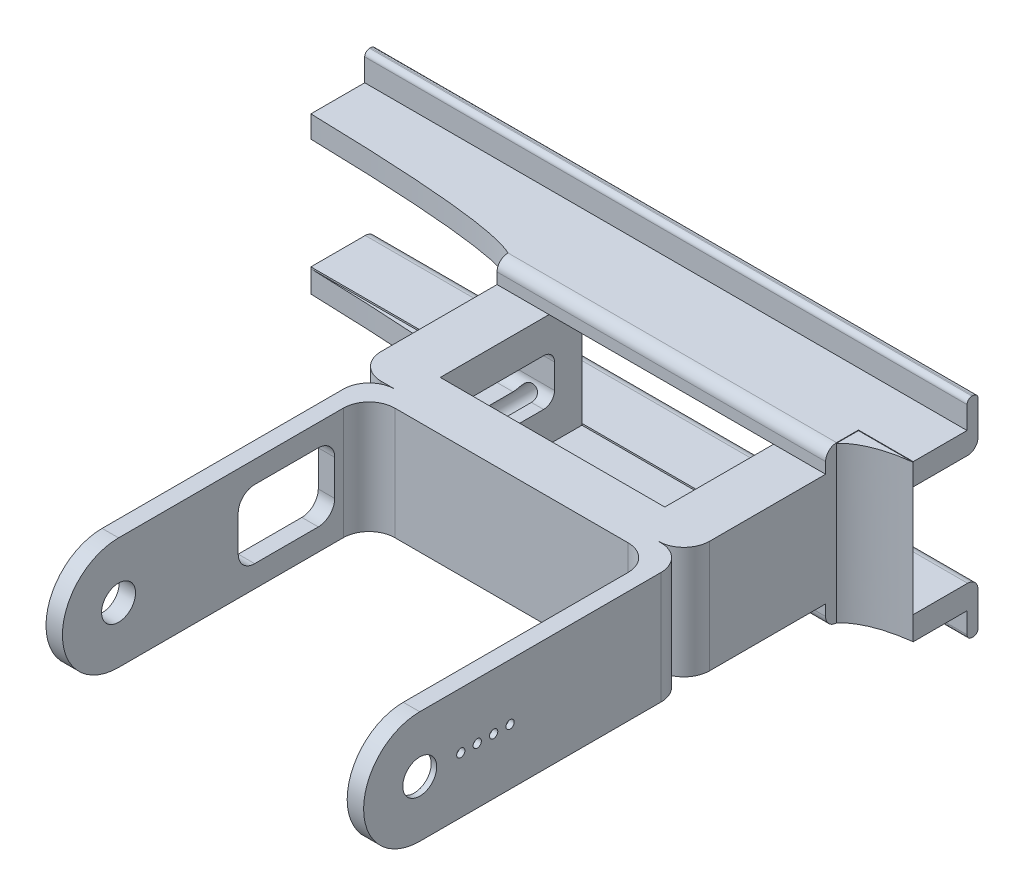
from build123d import *

# Parameters (mm, degrees)
AUFSATZ_LINEAR_AUSTRAGEN1_DEPTH      = 20.5
SCHNITT_LINEAR_AUSTRAGEN1_DEPTH      = 85.1
SKIZZE3_R                            = 3.1
SCHNITT_LINEAR_AUSTRAGEN2_DEPTH      = 87.42
SCHNITT_LINEAR_AUSTRAGEN3_DEPTH      = 2
SKIZZE5_R                            = 0.75
SCHNITT_LINEAR_AUSTRAGEN4_DEPTH      = 2
AUFSATZ_LINEAR_AUSTRAGEN2_DEPTH      = 20.5
SKIZZE7_W                            = 9.5
SKIZZE7_H                            = 20.5
AUFSATZ_LINEAR_AUSTRAGEN3_DEPTH      = 25.87
SCHNITT_LINEAR_AUSTRAGEN5_DEPTH      = 18.09
SKIZZE9_R                            = 1.75
SCHNITT_LINEAR_AUSTRAGEN6_DEPTH      = 24.9
AUFSATZ_LINEAR_AUSTRAGEN4_DEPTH      = 60
AUFSATZ_LINEAR_AUSTRAGEN5_DEPTH      = 40
AUFSATZ_LINEAR_AUSTRAGEN5_DEPTH_BACK = 70
AUFSATZ_LINEAR_AUSTRAGEN6_DEPTH      = 4
AUFSATZ_LINEAR_AUSTRAGEN7_DEPTH      = 4
AUFSATZ_LINEAR_AUSTRAGEN8_DEPTH      = 28.4
SCHNITT_LINEAR_AUSTRAGEN7_DEPTH      = 3


with BuildPart() as part:
    # Skizze1 → Aufsatz-Linear austragen1 (new body)
    with BuildSketch(Plane(origin=(0, 0, 0), x_dir=(1, 0, 0), z_dir=(0, 1, 0))):
        with BuildLine():
            Line((0, 54.3), (0, 0))
            Line((0, 0), (3, 0))
            Line((3, 0), (3, 51.3))
            ThreePointArc((3, 51.3), (4.376598128, 54.623401872), (7.7, 56))
            Line((7.7, 56), (50.3, 56))
            ThreePointArc((50.3, 56), (53.623401872, 54.623401872), (55, 51.3))
            Line((55, 51.3), (55, 0))
            Line((55, 0), (58, 0))
            Line((58, 0), (58, 54.3))
            ThreePointArc((58, 54.3), (56.623401872, 57.623401872), (53.3, 59))
            Line((53.3, 59), (4.7, 59))
            ThreePointArc((4.7, 59), (1.376598128, 57.623401872), (0, 54.3))
        make_face()
    extrude(amount=AUFSATZ_LINEAR_AUSTRAGEN1_DEPTH)

    # Skizze2 → Schnitt-Linear austragen1 (cut)
    with BuildSketch(Plane(origin=(58, 0, 0), x_dir=(0, 0, -1), z_dir=(1, 0, 0))):
        with BuildLine():
            ThreePointArc((0, 10.25), (3.002155493, 17.497844507), (10.25, 20.5))
            Line((10.25, 20.5), (0, 20.5))
            Line((0, 20.5), (0, 10.25))
        make_face()
        with BuildLine():
            ThreePointArc((10.25, 0), (3.002155493, 3.002155493), (0, 10.25))
            Line((0, 10.25), (0, 0))
            Line((0, 0), (10.25, 0))
        make_face()
    extrude(amount=-SCHNITT_LINEAR_AUSTRAGEN1_DEPTH, mode=Mode.SUBTRACT)

    # Skizze3 → Schnitt-Linear austragen2 (cut)
    with BuildSketch(Plane(origin=(58, 0, 0), x_dir=(0, 0, -1), z_dir=(1, 0, 0))):
        with Locations((10.25, 10.25)):
            Circle(SKIZZE3_R)
    extrude(amount=-SCHNITT_LINEAR_AUSTRAGEN2_DEPTH, mode=Mode.SUBTRACT)

    # Skizze4 → Schnitt-Linear austragen3 (cut)
    with BuildSketch(Plane.ZY.offset(-55)):
        with BuildLine():
            Line((-12.895262454, 4.367384373), (-27.5, 7.5))
            ThreePointArc((-27.5, 7.5), (-30, 10), (-27.5, 12.5))
            Line((-27.5, 12.5), (-13.215100612, 15.978067599))
            ThreePointArc((-13.215100612, 15.978067599), (-3.802439634, 10.427610206), (-12.895262454, 4.367384373))
        make_face()
    extrude(amount=-SCHNITT_LINEAR_AUSTRAGEN3_DEPTH, mode=Mode.SUBTRACT)

    # Skizze5 → Schnitt-Linear austragen4 (cut)
    with BuildSketch(Plane.ZY.offset(-57)):
        with Locations((-26.749999999, 10.249909889)):
            Circle(SKIZZE5_R)
        with Locations((-23.75, 10.25)):
            Circle(SKIZZE5_R)
        with Locations((-20.75, 10.25)):
            Circle(SKIZZE5_R)
        with Locations((-17.75, 10.25)):
            Circle(SKIZZE5_R)
    extrude(amount=-SCHNITT_LINEAR_AUSTRAGEN4_DEPTH, mode=Mode.SUBTRACT)

    # Skizze6 → Aufsatz-Linear austragen2 (add, through all)
    with BuildSketch(Plane.XZ):
        with BuildLine():
            Line((29, -59), (2.2, -59))
            ThreePointArc((2.2, -59), (-1.123401872, -60.376598128), (-2.5, -63.7))
            Line((-2.5, -63.7), (-2.5, -65))
            Line((-2.5, -65), (27.5, -65))
            Line((27.5, -65), (57.5, -65))
            Line((57.5, -65), (57.5, -63.7))
            ThreePointArc((57.5, -63.7), (56.123401872, -60.376598128), (52.8, -59))
            Line((52.8, -59), (29, -59))
        make_face()
    extrude(amount=-AUFSATZ_LINEAR_AUSTRAGEN2_DEPTH)

    # Skizze7 → Aufsatz-Linear austragen3 (add)
    with BuildSketch(Plane(origin=(0, 0, -65), x_dir=(-1, 0, 0), z_dir=(0, 0, -1))):
        with Locations((-52.75, 10.25)):
            Rectangle(SKIZZE7_W, SKIZZE7_H)
        with Locations((-2.25, 10.25)):
            Rectangle(SKIZZE7_W, SKIZZE7_H)
    extrude(amount=AUFSATZ_LINEAR_AUSTRAGEN3_DEPTH)

    # Skizze8 → Schnitt-Linear austragen5 (cut)
    with BuildSketch(Plane.ZY.offset(2.5)):
        with BuildLine():
            Line((-83.87, 14.5), (-67.2, 14.5))
            ThreePointArc((-67.2, 14.5), (-65.785786438, 13.914213562), (-65.2, 12.5))
            Line((-65.2, 12.5), (-65.2, 8))
            ThreePointArc((-65.2, 8), (-65.785786438, 6.585786438), (-67.2, 6))
            Line((-67.2, 6), (-83.87, 6))
            ThreePointArc((-83.87, 6), (-85.284213562, 6.585786438), (-85.87, 8))
            Line((-85.87, 8), (-85.87, 12.5))
            ThreePointArc((-85.87, 12.5), (-85.284213562, 13.914213562), (-83.87, 14.5))
        make_face()
    extrude(amount=-SCHNITT_LINEAR_AUSTRAGEN5_DEPTH, mode=Mode.SUBTRACT)

    # Skizze9 → Schnitt-Linear austragen6 (cut)
    with BuildSketch(Plane(origin=(0, 0, -90.87), x_dir=(-1, 0, 0), z_dir=(0, 0, -1))):
        with Locations((-3.1, 5.5)):
            Circle(SKIZZE9_R)
        with Locations((-3.1, 15.5)):
            Circle(SKIZZE9_R)
        with Locations((-51.9, 5.5)):
            Circle(SKIZZE9_R)
        with Locations((-51.9, 15.5)):
            Circle(SKIZZE9_R)
    extrude(amount=-SCHNITT_LINEAR_AUSTRAGEN6_DEPTH, mode=Mode.SUBTRACT)

    # Skizze10 → Aufsatz-Linear austragen4 (add, through all)
    with BuildSketch(Plane(origin=(57.5, 0, 0), x_dir=(0, 0, -1), z_dir=(1, 0, 0))):
        with BuildLine():
            Line((90.87, 20.5), (84.87, 20.5))
            Line((84.87, 20.5), (84.87, 22.5))
            ThreePointArc((84.87, 22.5), (85.455786438, 23.914213562), (86.87, 24.5))
            Line((86.87, 24.5), (90.87, 24.5))
            Line((90.87, 24.5), (90.87, 20.5))
        make_face()
        with BuildLine():
            Line((90.87, 0), (84.87, 0))
            Line((84.87, 0), (84.87, -2))
            ThreePointArc((84.87, -2), (85.455786438, -3.414213562), (86.87, -4))
            Line((86.87, -4), (90.87, -4))
            Line((90.87, -4), (90.87, 0))
        make_face()
    extrude(amount=-AUFSATZ_LINEAR_AUSTRAGEN4_DEPTH)

    # Skizze11 → Aufsatz-Linear austragen5 (add, two sides: drawn at the far end of the back side and taken through both)
    with BuildSketch(Plane.ZY.offset(2.5).offset(-AUFSATZ_LINEAR_AUSTRAGEN5_DEPTH_BACK)):
        with BuildLine():
            Line((-90.87, 24.5), (-100.7, 24.5))
            Line((-100.7, 24.5), (-100.7, 28.6))
            ThreePointArc((-100.7, 28.6), (-100.963603897, 29.236396103), (-101.6, 29.5))
            Line((-101.6, 29.5), (-101.8, 29.5))
            ThreePointArc((-101.8, 29.5), (-102.436396103, 29.236396103), (-102.7, 28.6))
            Line((-102.7, 28.6), (-102.7, 22.4))
            ThreePointArc((-102.7, 22.4), (-102.143502884, 21.056497116), (-100.8, 20.5))
            Line((-100.8, 20.5), (-100.7, 20.5))
            Line((-100.7, 20.5), (-90.87, 20.5))
            Line((-90.87, 20.5), (-90.87, 24.5))
        make_face()
        with BuildLine():
            Line((-90.87, -4), (-100.7, -4))
            Line((-100.7, -4), (-100.7, -7.8))
            ThreePointArc((-100.7, -7.8), (-100.963603897, -8.436396103), (-101.6, -8.7))
            Line((-101.6, -8.7), (-101.8, -8.7))
            ThreePointArc((-101.8, -8.7), (-102.436396103, -8.436396103), (-102.7, -7.8))
            Line((-102.7, -7.8), (-102.7, -1.6))
            ThreePointArc((-102.7, -1.6), (-102.143502884, -0.256497116), (-100.8, 0.3))
            Line((-100.8, 0.3), (-100.7, 0.3))
            Line((-100.7, 0.3), (-90.87, 0.3))
            Line((-90.87, 0.3), (-90.87, -4))
        make_face()
    extrude(amount=AUFSATZ_LINEAR_AUSTRAGEN5_DEPTH + AUFSATZ_LINEAR_AUSTRAGEN5_DEPTH_BACK)

    # Skizze12 → Aufsatz-Linear austragen6 (add)
    with BuildSketch(Plane(origin=(0, 24.5, 0), x_dir=(1, 0, 0), z_dir=(0, 1, 0))):
        with BuildLine():
            Line((-42.5, 90.87), (-2.5, 90.87))
            Line((-2.5, 90.87), (-2.5, 86.87))
            add(Edge.make_bspline(
                [(-42.5, 90.87), (-9.080607123, 90.092835271), (-2.5, 86.87)],
                knots=[0, 0, 0, 1, 1, 1], degree=2))
        make_face()
    extrude(amount=-AUFSATZ_LINEAR_AUSTRAGEN6_DEPTH)

    # Skizze13 → Aufsatz-Linear austragen7 (add)
    with BuildSketch(Plane.XZ.offset(4)):
        with BuildLine():
            Line((-2.5, -86.87), (-2.5, -90.87))
            Line((-2.5, -90.87), (-42.5, -90.87))
            add(Edge.make_bspline(
                [(-42.5, -90.87), (-8.320155044, -89.830707386), (-2.5, -86.87)],
                knots=[0, 0, 0, 1, 1, 1], degree=2))
        make_face()
    extrude(amount=-AUFSATZ_LINEAR_AUSTRAGEN7_DEPTH)

    # Skizze14 → Aufsatz-Linear austragen8 (add)
    with BuildSketch(Plane.XZ.offset(4)):
        with BuildLine():
            Line((57.5, -86.87), (57.5, -90.87))
            Line((57.5, -90.87), (67.5, -90.87))
            add(Edge.make_bspline(
                [(57.5, -86.87), (60.425368179, -89.995001665), (67.5, -90.87)],
                knots=[0, 0, 0, 1, 1, 1], degree=2))
        make_face()
    extrude(amount=-AUFSATZ_LINEAR_AUSTRAGEN8_DEPTH)

    # Skizze16 → Schnitt-Linear austragen7 (cut)
    with BuildSketch(Plane.ZY):
        with BuildLine():
            Line((-46.721244461, 4), (-35.100330168, 4))
            ThreePointArc((-35.100330168, 4), (-32.979009824, 4.878679656), (-32.100330168, 7))
            Line((-32.100330168, 7), (-32.100330168, 13.5))
            ThreePointArc((-32.100330168, 13.5), (-32.979009824, 15.621320344), (-35.100330168, 16.5))
            Line((-35.100330168, 16.5), (-46.721244461, 16.5))
            ThreePointArc((-46.721244461, 16.5), (-48.842564804, 15.621320344), (-49.721244461, 13.5))
            Line((-49.721244461, 13.5), (-49.721244461, 7))
            ThreePointArc((-49.721244461, 7), (-48.842564804, 4.878679656), (-46.721244461, 4))
        make_face()
    extrude(amount=-SCHNITT_LINEAR_AUSTRAGEN7_DEPTH, mode=Mode.SUBTRACT)


solid = part.part
